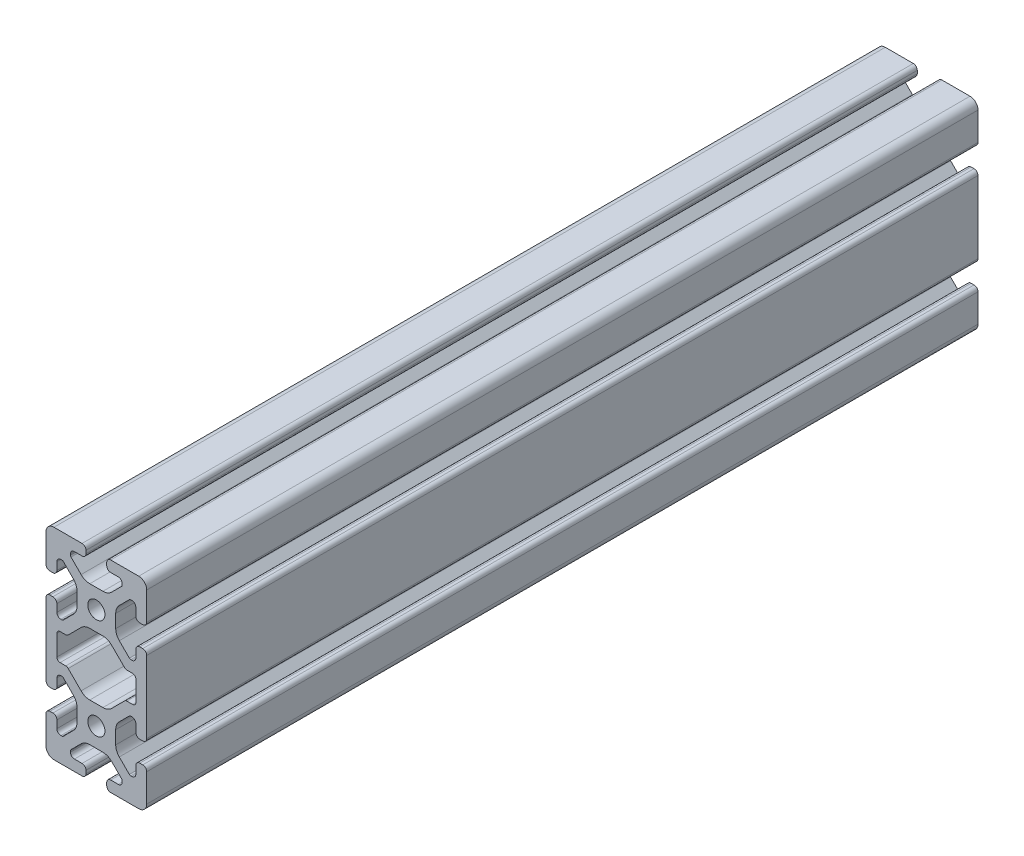
from build123d import *

# Parameters (mm, degrees)
SKETCH1_R           = 3.405
BOSS_EXTRUDE1_DEPTH = 3048
SKETCH26_W          = 40
SKETCH26_H          = 80.80011746
CUT_1_3FT_DEPTH     = 2135.537177001
SKETCH33_W          = 40
SKETCH33_H          = 80.80011746
CUT_2_3FT_DEPTH     = 1221.839317847
SKETCH41_W          = 40
SKETCH41_H          = 80.80011746
CUT_3_1FT_1IN_DEPTH = 892.246879377


with BuildPart() as part:
    # Sketch1 → Boss-Extrude1 (new body)
    with BuildSketch(Plane(origin=(0, 0, -3048), x_dir=(-1, 0, 0), z_dir=(0, 0, -1))):
        with BuildLine():
            Line((16.83, 60), (5.69044933, 60))
            ThreePointArc((5.69044933, 60), (4.580291684, 59.540157646), (4.12044933, 58.43))
            Line((4.12044933, 58.43), (4.12044933, 57.25))
            ThreePointArc((4.12044933, 57.25), (4.580291684, 56.139842354), (5.69044933, 55.68))
            Line((5.69044933, 55.68), (8.7153995, 55.68))
            ThreePointArc((8.7153995, 55.68), (9.825557146, 55.220157646), (10.2853995, 54.11))
            Line((10.2853995, 54.11), (10.2853995, 53.654903102))
            ThreePointArc((10.2853995, 53.654903102), (10.227547945, 53.364063694), (10.062800654, 53.117501948))
            Line((10.062800654, 53.117501948), (6.055092794, 49.109794088))
            ThreePointArc((6.055092794, 49.109794088), (4.47691877, 48.055291919), (2.615335582, 47.685))
            Line((2.615335582, 47.685), (-2.615335582, 47.685))
            ThreePointArc((-2.615335582, 47.685), (-4.47691877, 48.055291919), (-6.055092794, 49.109794088))
            Line((-6.055092794, 49.109794088), (-10.062800654, 53.117501948))
            ThreePointArc((-10.062800654, 53.117501948), (-10.227547945, 53.364063694), (-10.2853995, 53.654903102))
            Line((-10.2853995, 53.654903102), (-10.2853995, 54.11))
            ThreePointArc((-10.2853995, 54.11), (-9.825557146, 55.220157646), (-8.7153995, 55.68))
            Line((-8.7153995, 55.68), (-5.69044933, 55.68))
            ThreePointArc((-5.69044933, 55.68), (-4.580291684, 56.139842354), (-4.12044933, 57.25))
            Line((-4.12044933, 57.25), (-4.12044933, 58.43))
            ThreePointArc((-4.12044933, 58.43), (-4.580291684, 59.540157646), (-5.69044933, 60))
            Line((-5.69044933, 60), (-16.83, 60))
            ThreePointArc((-16.83, 60), (-19.071528496, 59.071528496), (-20, 56.83))
            Line((-20, 56.83), (-20, 45.69044933))
            ThreePointArc((-20, 45.69044933), (-19.540157646, 44.580291684), (-18.43, 44.12044933))
            Line((-18.43, 44.12044933), (-17.25, 44.12044933))
            ThreePointArc((-17.25, 44.12044933), (-16.139842354, 44.580291684), (-15.68, 45.69044933))
            Line((-15.68, 45.69044933), (-15.68, 48.7153995))
            ThreePointArc((-15.68, 48.7153995), (-15.220157646, 49.825557146), (-14.11, 50.2853995))
            Line((-14.11, 50.2853995), (-13.652670816, 50.2853995))
            ThreePointArc((-13.652670816, 50.2853995), (-13.361831408, 50.227547945), (-13.115269662, 50.062800654))
            Line((-13.115269662, 50.062800654), (-9.109794088, 46.05732508))
            ThreePointArc((-9.109794088, 46.05732508), (-8.055291919, 44.479151056), (-7.685, 42.617567868))
            Line((-7.685, 42.617567868), (-7.685, 37.384664418))
            ThreePointArc((-7.685, 37.384664418), (-8.055291919, 35.52308123), (-9.109794088, 33.944907206))
            Line((-9.109794088, 33.944907206), (-13.117501948, 29.937199346))
            ThreePointArc((-13.117501948, 29.937199346), (-13.364063694, 29.772452055), (-13.654903102, 29.7146005))
            Line((-13.654903102, 29.7146005), (-14.11, 29.7146005))
            ThreePointArc((-14.11, 29.7146005), (-15.220157646, 30.174442854), (-15.68, 31.2846005))
            Line((-15.68, 31.2846005), (-15.68, 34.30955067))
            ThreePointArc((-15.68, 34.30955067), (-16.139842354, 35.419708316), (-17.25, 35.87955067))
            Line((-17.25, 35.87955067), (-18.43, 35.87955067))
            ThreePointArc((-18.43, 35.87955067), (-19.540157646, 35.419708316), (-20, 34.30955067))
            Line((-20, 34.30955067), (-20, 5.69044933))
            ThreePointArc((-20, 5.69044933), (-19.540157646, 4.580291684), (-18.43, 4.12044933))
            Line((-18.43, 4.12044933), (-17.25, 4.12044933))
            ThreePointArc((-17.25, 4.12044933), (-16.139842354, 4.580291684), (-15.68, 5.69044933))
            Line((-15.68, 5.69044933), (-15.68, 8.7153995))
            ThreePointArc((-15.68, 8.7153995), (-15.220157646, 9.825557146), (-14.11, 10.2853995))
            Line((-14.11, 10.2853995), (-13.654903102, 10.2853995))
            ThreePointArc((-13.654903102, 10.2853995), (-13.364063694, 10.227547945), (-13.117501948, 10.062800654))
            Line((-13.117501948, 10.062800654), (-9.109794088, 6.055092794))
            ThreePointArc((-9.109794088, 6.055092794), (-8.055291919, 4.47691877), (-7.685, 2.615335582))
            Line((-7.685, 2.615335582), (-7.685, -2.615335582))
            ThreePointArc((-7.685, -2.615335582), (-8.055291919, -4.47691877), (-9.109794088, -6.055092794))
            Line((-9.109794088, -6.055092794), (-13.117501948, -10.062800654))
            ThreePointArc((-13.117501948, -10.062800654), (-13.364063694, -10.227547945), (-13.654903102, -10.2853995))
            Line((-13.654903102, -10.2853995), (-14.11, -10.2853995))
            ThreePointArc((-14.11, -10.2853995), (-15.220157646, -9.825557146), (-15.68, -8.7153995))
            Line((-15.68, -8.7153995), (-15.68, -5.69044933))
            ThreePointArc((-15.68, -5.69044933), (-16.139842354, -4.580291684), (-17.25, -4.12044933))
            Line((-17.25, -4.12044933), (-18.43, -4.12044933))
            ThreePointArc((-18.43, -4.12044933), (-19.540157646, -4.580291684), (-20, -5.69044933))
            Line((-20, -5.69044933), (-20, -16.83))
            ThreePointArc((-20, -16.83), (-19.071528496, -19.071528496), (-16.83, -20))
            Line((-16.83, -20), (-5.69044933, -20))
            ThreePointArc((-5.69044933, -20), (-4.580291684, -19.540157646), (-4.12044933, -18.43))
            Line((-4.12044933, -18.43), (-4.12044933, -17.25))
            ThreePointArc((-4.12044933, -17.25), (-4.580291684, -16.139842354), (-5.69044933, -15.68))
            Line((-5.69044933, -15.68), (-8.7153995, -15.68))
            ThreePointArc((-8.7153995, -15.68), (-9.825557146, -15.220157646), (-10.2853995, -14.11))
            Line((-10.2853995, -14.11), (-10.2853995, -13.654903102))
            ThreePointArc((-10.2853995, -13.654903102), (-10.227547945, -13.364063694), (-10.062800654, -13.117501948))
            Line((-10.062800654, -13.117501948), (-6.055092794, -9.109794088))
            ThreePointArc((-6.055092794, -9.109794088), (-4.47691877, -8.055291919), (-2.615335582, -7.685))
            Line((-2.615335582, -7.685), (2.615335582, -7.685))
            ThreePointArc((2.615335582, -7.685), (4.47691877, -8.055291919), (6.055092794, -9.109794088))
            Line((6.055092794, -9.109794088), (10.062800654, -13.117501948))
            ThreePointArc((10.062800654, -13.117501948), (10.227547945, -13.364063694), (10.2853995, -13.654903102))
            Line((10.2853995, -13.654903102), (10.2853995, -14.11))
            ThreePointArc((10.2853995, -14.11), (9.825557146, -15.220157646), (8.7153995, -15.68))
            Line((8.7153995, -15.68), (5.69044933, -15.68))
            ThreePointArc((5.69044933, -15.68), (4.580291684, -16.139842354), (4.12044933, -17.25))
            Line((4.12044933, -17.25), (4.12044933, -18.43))
            ThreePointArc((4.12044933, -18.43), (4.580291684, -19.540157646), (5.69044933, -20))
            Line((5.69044933, -20), (16.83, -20))
            ThreePointArc((16.83, -20), (19.071528496, -19.071528496), (20, -16.83))
            Line((20, -16.83), (20, -5.69044933))
            ThreePointArc((20, -5.69044933), (19.540157646, -4.580291684), (18.43, -4.12044933))
            Line((18.43, -4.12044933), (17.25, -4.12044933))
            ThreePointArc((17.25, -4.12044933), (16.139842354, -4.580291684), (15.68, -5.69044933))
            Line((15.68, -5.69044933), (15.68, -8.7153995))
            ThreePointArc((15.68, -8.7153995), (15.220157646, -9.825557146), (14.11, -10.2853995))
            Line((14.11, -10.2853995), (13.654903102, -10.2853995))
            ThreePointArc((13.654903102, -10.2853995), (13.364063694, -10.227547945), (13.117501948, -10.062800654))
            Line((13.117501948, -10.062800654), (9.109794088, -6.055092794))
            ThreePointArc((9.109794088, -6.055092794), (8.055291919, -4.47691877), (7.685, -2.615335582))
            Line((7.685, -2.615335582), (7.685, 2.615335582))
            ThreePointArc((7.685, 2.615335582), (8.055291919, 4.47691877), (9.109794088, 6.055092794))
            Line((9.109794088, 6.055092794), (13.117501948, 10.062800654))
            ThreePointArc((13.117501948, 10.062800654), (13.364063694, 10.227547945), (13.654903102, 10.2853995))
            Line((13.654903102, 10.2853995), (14.11, 10.2853995))
            ThreePointArc((14.11, 10.2853995), (15.220157646, 9.825557146), (15.68, 8.7153995))
            Line((15.68, 8.7153995), (15.68, 5.69044933))
            ThreePointArc((15.68, 5.69044933), (16.139842354, 4.580291684), (17.25, 4.12044933))
            Line((17.25, 4.12044933), (18.43, 4.12044933))
            ThreePointArc((18.43, 4.12044933), (19.540157646, 4.580291684), (20, 5.69044933))
            Line((20, 5.69044933), (20, 34.30955067))
            ThreePointArc((20, 34.30955067), (19.540157646, 35.419708316), (18.43, 35.87955067))
            Line((18.43, 35.87955067), (17.25, 35.87955067))
            ThreePointArc((17.25, 35.87955067), (16.139842354, 35.419708316), (15.68, 34.30955067))
            Line((15.68, 34.30955067), (15.68, 31.2846005))
            ThreePointArc((15.68, 31.2846005), (15.220157646, 30.174442854), (14.11, 29.7146005))
            Line((14.11, 29.7146005), (13.654903102, 29.7146005))
            ThreePointArc((13.654903102, 29.7146005), (13.364063694, 29.772452055), (13.117501948, 29.937199346))
            Line((13.117501948, 29.937199346), (9.109794088, 33.944907206))
            ThreePointArc((9.109794088, 33.944907206), (8.055291919, 35.52308123), (7.685, 37.384664418))
            Line((7.685, 37.384664418), (7.685, 42.615335582))
            ThreePointArc((7.685, 42.615335582), (8.055291919, 44.47691877), (9.109794088, 46.055092794))
            Line((9.109794088, 46.055092794), (13.117501948, 50.062800654))
            ThreePointArc((13.117501948, 50.062800654), (13.364063694, 50.227547945), (13.654903102, 50.2853995))
            Line((13.654903102, 50.2853995), (14.11, 50.2853995))
            ThreePointArc((14.11, 50.2853995), (15.220157646, 49.825557146), (15.68, 48.7153995))
            Line((15.68, 48.7153995), (15.68, 45.69044933))
            ThreePointArc((15.68, 45.69044933), (16.139842354, 44.580291684), (17.25, 44.12044933))
            Line((17.25, 44.12044933), (18.43, 44.12044933))
            ThreePointArc((18.43, 44.12044933), (19.540157646, 44.580291684), (20, 45.69044933))
            Line((20, 45.69044933), (20, 56.83))
            ThreePointArc((20, 56.83), (19.071528496, 59.071528496), (16.83, 60))
        make_face()
        with Locations(Location((0, 0, 0), (0, 0, 180))):
            Circle(SKETCH1_R, mode=Mode.SUBTRACT)
        with Locations(Location((0, 40, 0), (0, 0, 180))):
            Circle(SKETCH1_R, mode=Mode.SUBTRACT)
        with BuildLine():
            Line((14.41, 14.65864833), (12.129998259, 14.65864833))
            ThreePointArc((12.129998259, 14.65864833), (11.608780622, 14.546764116), (11.179399246, 14.230824983))
            Line((11.179399246, 14.230824983), (6.055092794, 9.109794088))
            ThreePointArc((6.055092794, 9.109794088), (4.47691877, 8.055291919), (2.615335582, 7.685))
            Line((2.615335582, 7.685), (-2.615335582, 7.685))
            ThreePointArc((-2.615335582, 7.685), (-4.47691877, 8.055291919), (-6.055092794, 9.109794088))
            Line((-6.055092794, 9.109794088), (-11.231972647, 14.286673942))
            ThreePointArc((-11.231972647, 14.286673942), (-11.6439903, 14.561975336), (-12.129998259, 14.65864833))
            Line((-12.129998259, 14.65864833), (-14.41, 14.65864833))
            ThreePointArc((-14.41, 14.65864833), (-15.308025612, 15.030622718), (-15.68, 15.92864833))
            Line((-15.68, 15.92864833), (-15.68, 24.07135167))
            ThreePointArc((-15.68, 24.07135167), (-15.308025612, 24.969377282), (-14.41, 25.34135167))
            Line((-14.41, 25.34135167), (-12.129998259, 25.34135167))
            ThreePointArc((-12.129998259, 25.34135167), (-11.6439903, 25.438024664), (-11.231972647, 25.713326058))
            Line((-11.231972647, 25.713326058), (-6.055092794, 30.890205912))
            ThreePointArc((-6.055092794, 30.890205912), (-4.47691877, 31.944708081), (-2.615335582, 32.315))
            Line((-2.615335582, 32.315), (2.617567868, 32.315))
            ThreePointArc((2.617567868, 32.315), (4.479151056, 31.944708081), (6.05732508, 30.890205912))
            Line((6.05732508, 30.890205912), (11.184160745, 25.763370247))
            ThreePointArc((11.184160745, 25.763370247), (11.612140102, 25.451641766), (12.129998259, 25.34135167))
            Line((12.129998259, 25.34135167), (14.41, 25.34135167))
            ThreePointArc((14.41, 25.34135167), (15.308025612, 24.969377282), (15.68, 24.07135167))
            Line((15.68, 24.07135167), (15.68, 15.92864833))
            ThreePointArc((15.68, 15.92864833), (15.308025612, 15.030622718), (14.41, 14.65864833))
        make_face(mode=Mode.SUBTRACT)
    extrude(amount=-BOSS_EXTRUDE1_DEPTH)

    # Sketch26 → Cut 1 - 3ft (cut, through all)
    with BuildSketch(Plane.XY.offset(-914.4)):
        with Locations((0, 19.59994127)):
            Rectangle(SKETCH26_W, SKETCH26_H)
    extrude(amount=CUT_1_3FT_DEPTH, mode=Mode.SUBTRACT)

    # Sketch33 → Cut 2 - 3ft (cut, through all)
    with BuildSketch(Plane.XY.offset(-1828.8)):
        with Locations((0, 19.59994127)):
            Rectangle(SKETCH33_W, SKETCH33_H)
    extrude(amount=CUT_2_3FT_DEPTH, mode=Mode.SUBTRACT)

    # Sketch41 → Cut 3 - 1ft + 1in (cut, through all)
    with BuildSketch(Plane.XY.offset(-2159)):
        with Locations((0, 19.59994127)):
            Rectangle(SKETCH41_W, SKETCH41_H)
    extrude(amount=-CUT_3_1FT_1IN_DEPTH, mode=Mode.SUBTRACT)


solid = part.part
